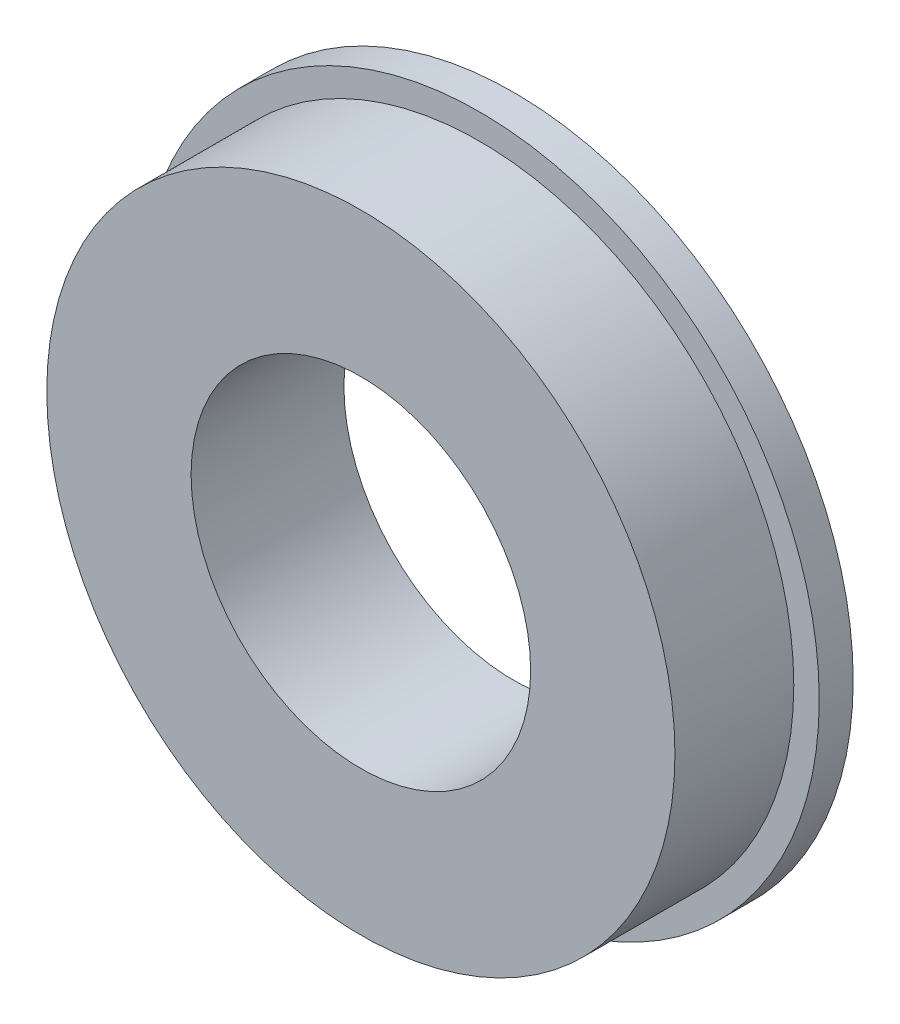
from build123d import *

# Parameters (mm, degrees)
SKETCH_1_R          = 20
EXTRUDE_1_DEPTH     = 2
SKETCH_2_R          = 18.5
EXTRUDE_2_DEPTH     = 7
SKETCH_3_R          = 10
CUT_EXTRUDE_1_DEPTH = 30.681644159
SKETCH_4_R          = 16.638615911
SKETCH_4_R_2        = 14.166384124
CUT_EXTRUDE_2_DEPTH = 0.5


with BuildPart() as part:
    # 草图1 → 凸台-拉伸1 (new body)
    with BuildSketch(Plane.XY):
        Circle(SKETCH_1_R)
    extrude(amount=EXTRUDE_1_DEPTH)

    # 草图2 → 凸台-拉伸2 (add)
    with BuildSketch(Plane.XY.offset(2)):
        Circle(SKETCH_2_R)
    extrude(amount=EXTRUDE_2_DEPTH)

    # 草图3 → 切除-拉伸1 (cut, through all)
    with BuildSketch(Plane.XY.offset(9)):
        Circle(SKETCH_3_R)
    extrude(amount=-CUT_EXTRUDE_1_DEPTH, mode=Mode.SUBTRACT)

    # 草图4 → 切除-拉伸2 (cut)
    with BuildSketch(Plane(origin=(0, 0, 0), x_dir=(-1, 0, 0), z_dir=(0, 0, -1))):
        Circle(SKETCH_4_R)
        Circle(SKETCH_4_R_2, mode=Mode.SUBTRACT)
    extrude(amount=-CUT_EXTRUDE_2_DEPTH, mode=Mode.SUBTRACT)


solid = part.part
